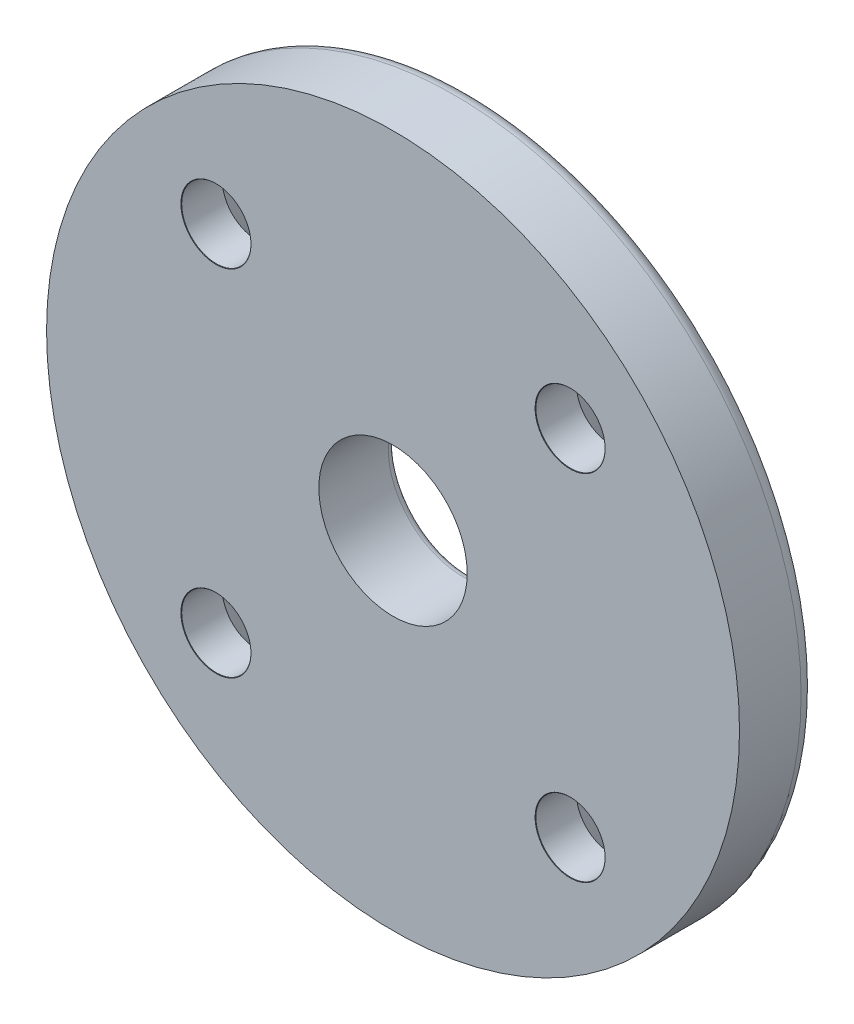
from build123d import *

# Parameters (mm, degrees)
SKIZZE1_R                                   = 22.5
SKIZZE1_R_2                                 = 4.818475195
SKIZZE1_R_3                                 = 2
AUFSATZ_LINEAR_AUSTRAGEN1_DEPTH             = 5
VERRUNDUNG1_R                               = 1
VERRUNDUNG2_R                               = 0.5
FORMSENKUNG_F_R_M4_SENKSCHRAUBE_MIT_2_COUNT = 2
FORMSENKUNG_F_R_M4_SENKSCHRAUBE_MIT_2_PITCH = 23
FORMSENKUNG_F_R_M4_SENKSCHRAUBE_MIT_3_COUNT = 2
FORMSENKUNG_F_R_M4_SENKSCHRAUBE_MIT_3_PITCH = 23
FORMSENKUNG_F_R_M4_SENKSCHRAUBE_MIT_4_COUNT = 2
FORMSENKUNG_F_R_M4_SENKSCHRAUBE_MIT_4_PITCH = 32.526911935


with BuildPart() as part:
    # Skizze1 → Aufsatz-Linear austragen1 (new body)
    with BuildSketch(Plane.XY):
        Circle(SKIZZE1_R)
        Circle(SKIZZE1_R_2, mode=Mode.SUBTRACT)
        with Locations((-11.5, 11.5)):
            Circle(SKIZZE1_R_3, mode=Mode.SUBTRACT)
        with Locations((11.5, 11.5)):
            Circle(SKIZZE1_R_3, mode=Mode.SUBTRACT)
        with Locations((-11.5, -11.5)):
            Circle(SKIZZE1_R_3, mode=Mode.SUBTRACT)
        with Locations((11.5, -11.5)):
            Circle(SKIZZE1_R_3, mode=Mode.SUBTRACT)
    extrude(amount=AUFSATZ_LINEAR_AUSTRAGEN1_DEPTH)

    # Verrundung1
    verrundung1_edges = [part.edges().sort_by_distance(p)[0] for p in [
        (-22.5, 0, 0),
    ]]
    fillet(verrundung1_edges, radius=VERRUNDUNG1_R)

    # Verrundung2
    verrundung2_edges = [part.edges().sort_by_distance(p)[0] for p in [
        (-4.818475195, 0, 0),
    ]]
    fillet(verrundung2_edges, radius=VERRUNDUNG2_R)

    # Skizze2 → Formsenkung für M4 Senkschraube mit Innensechskant1 (revolve, cut)
    with BuildSketch(Plane(origin=(11.5, 11.5, 0), x_dir=(0, 1, 0), z_dir=(1, 0, 0))):
        Polygon((0, 0), (0, 5), (2.275, 5), (2.25, 4.975), (2.25, 2.34), (4.59, 0), align=None)
    formsenkung_f_r_m4_senkschraube_mit_inne = revolve(axis=Axis((11.5, 11.5, -6.35), (0, 0, 1)), mode=Mode.SUBTRACT)

    # Formsenkung f_r M4 Senkschraube mit  2: Formsenkung für M4 Senkschraube mit Innensechskant1 ×2
    with Locations(*[(-i * FORMSENKUNG_F_R_M4_SENKSCHRAUBE_MIT_2_PITCH, 0, 0) for i in range(1, FORMSENKUNG_F_R_M4_SENKSCHRAUBE_MIT_2_COUNT)]):
        add(formsenkung_f_r_m4_senkschraube_mit_inne, mode=Mode.SUBTRACT)

    # Formsenkung f_r M4 Senkschraube mit  3: Formsenkung für M4 Senkschraube mit Innensechskant1 ×2
    with Locations(*[(0, -i * FORMSENKUNG_F_R_M4_SENKSCHRAUBE_MIT_3_PITCH, 0) for i in range(1, FORMSENKUNG_F_R_M4_SENKSCHRAUBE_MIT_3_COUNT)]):
        add(formsenkung_f_r_m4_senkschraube_mit_inne, mode=Mode.SUBTRACT)

    # Formsenkung f_r M4 Senkschraube mit  4: Formsenkung für M4 Senkschraube mit Innensechskant1 ×2
    with Locations(*[Vector(-0.7071067811865476, -0.7071067811865476, 0) * (i * FORMSENKUNG_F_R_M4_SENKSCHRAUBE_MIT_4_PITCH) for i in range(1, FORMSENKUNG_F_R_M4_SENKSCHRAUBE_MIT_4_COUNT)]):
        add(formsenkung_f_r_m4_senkschraube_mit_inne, mode=Mode.SUBTRACT)


solid = part.part
